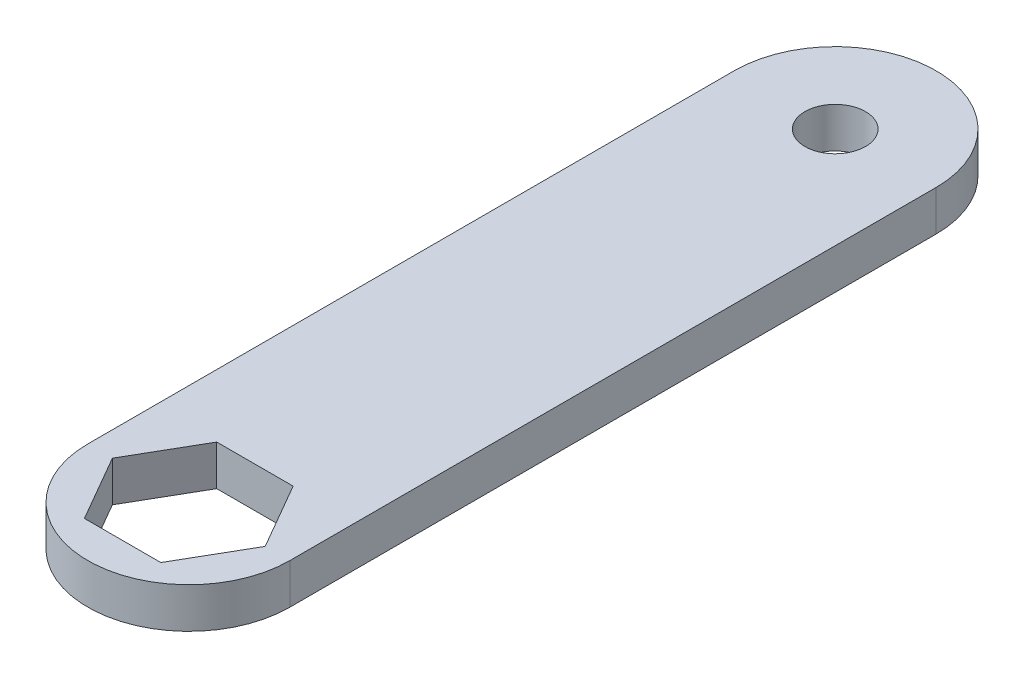
from build123d import *

# Parameters (mm, degrees)
SKETCH_1_R      = 1.5
EXTRUDE_1_DEPTH = 2


with BuildPart() as part:
    # 草图1 → 凸台-拉伸1 (new body)
    with BuildSketch(Plane(origin=(0, 0, 0), x_dir=(1, 0, 0), z_dir=(0, 1, 0))):
        with BuildLine():
            Line((-5, -16), (-5, 16))
            ThreePointArc((-5, 16), (0, 21), (5, 16))
            Line((5, 16), (5, -16))
            ThreePointArc((5, -16), (0, -21), (-5, -16))
        make_face()
        with Locations(Location((0, 16, 0), (0, 0, 270))):
            Circle(SKETCH_1_R, mode=Mode.SUBTRACT)
        Polygon((1.890822132, -12.725), (-1.890822132, -12.725), (-3.781644263, -16), (-1.890822132, -19.275), (1.890822132, -19.275), (3.781644263, -16), align=None, mode=Mode.SUBTRACT)
    extrude(amount=EXTRUDE_1_DEPTH)


solid = part.part
